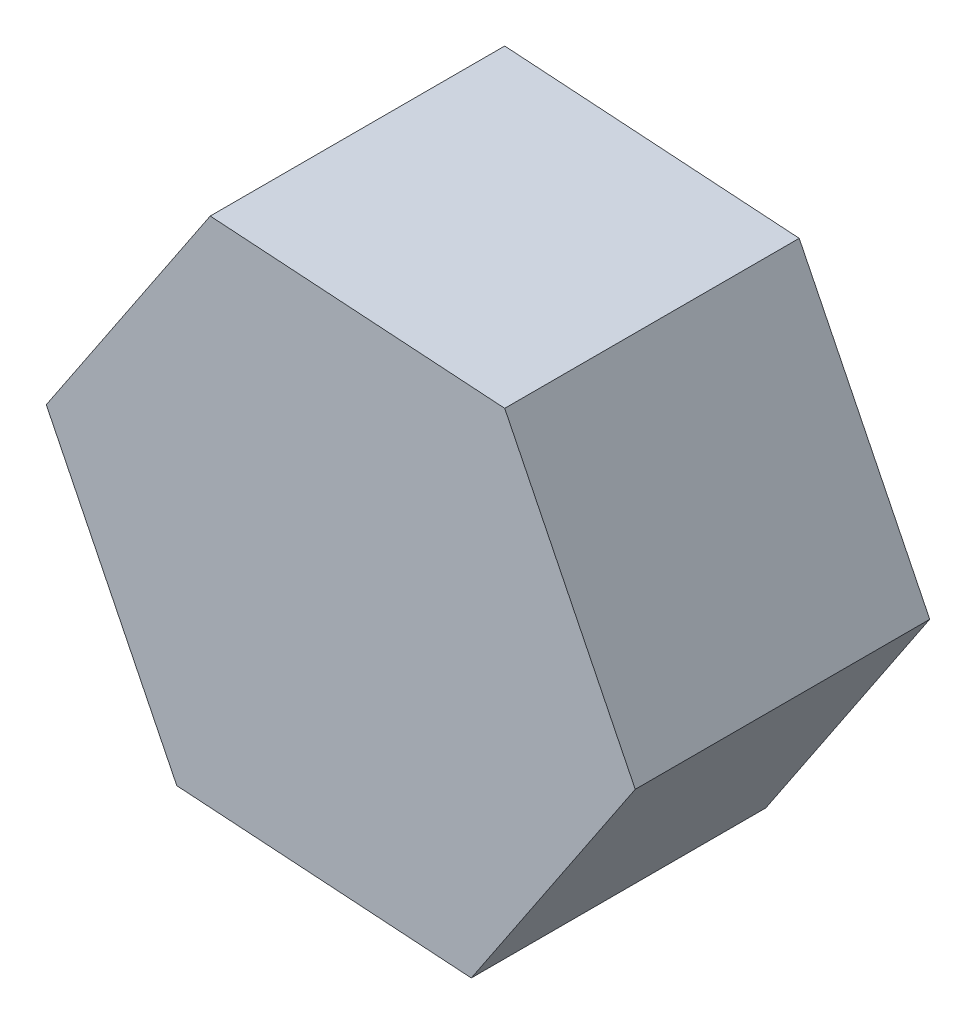
from build123d import *

# Parameters (mm, degrees)
BOSS_EXTRUDE1_DEPTH = 12


with BuildPart() as part:
    # Sketch1 → Boss-Extrude1 (new body)
    with BuildSketch(Plane.XY):
        Polygon((6.681164543, 9.999034313), (-5.318835457, 10.785575377), (-12, 0.786541064), (-6.681164543, -9.999034313), (5.318835457, -10.785575377), (12, -0.786541064), align=None)
    extrude(amount=BOSS_EXTRUDE1_DEPTH)


solid = part.part
